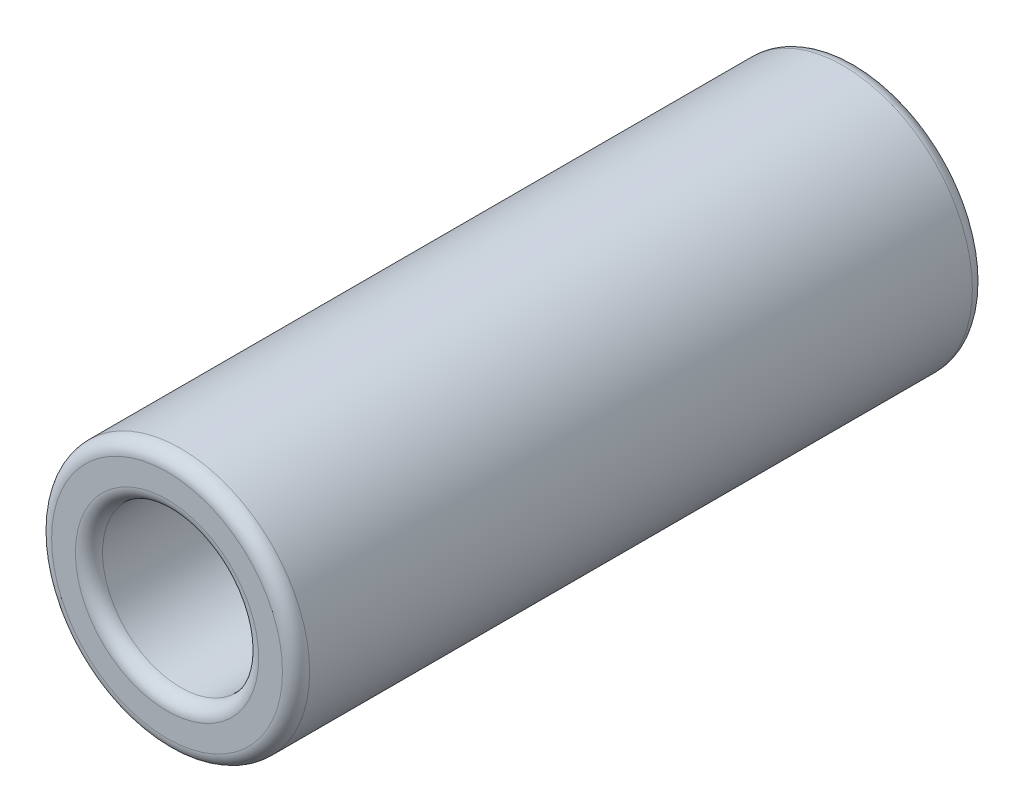
from build123d import *

# Parameters (mm, degrees)
ESQUISSE1_R      = 9.5
EXTRUSION1_DEPTH = 50.8
ESQUISSE2_R      = 5.75
EXTRUSION2_DEPTH = 53.546550791
FILLET1_R        = 1


with BuildPart() as part:
    # Esquisse1 → Extrusion1 (new body)
    with BuildSketch(Plane.XY):
        Circle(ESQUISSE1_R)
    extrude(amount=EXTRUSION1_DEPTH)

    # Esquisse2 → Extrusion2 (cut, through all)
    with BuildSketch(Plane.XY.offset(50.8)):
        Circle(ESQUISSE2_R)
    extrude(amount=-EXTRUSION2_DEPTH, mode=Mode.SUBTRACT)

    # Fillet1
    fillet1_edges = [part.edges().sort_by_distance(p)[0] for p in [
        (-9.5, 0, 0),
        (-9.5, 0, 50.8),
        (-5.75, 0, 0),
        (-5.75, 0, 50.8),
    ]]
    fillet(fillet1_edges, radius=FILLET1_R)


solid = part.part
